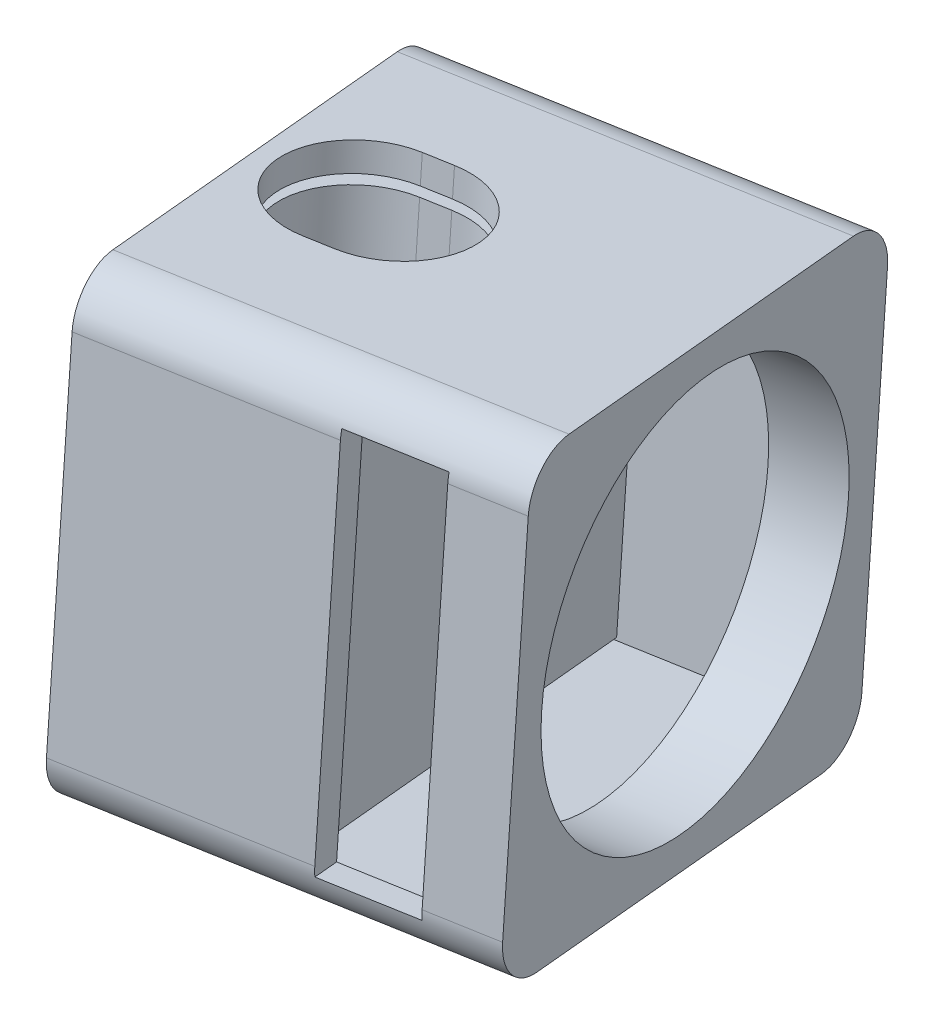
from build123d import *

# Parameters (mm, degrees)
SKETCH1_R           = 4.1
BOSS_EXTRUDE1_DEPTH = 1.5
BOSS_EXTRUDE2_DEPTH = 7
BOSS_EXTRUDE3_START = -7
BOSS_EXTRUDE3_DEPTH = 4.5
CUT_EXTRUDE1_DEPTH  = 45.370101856
FILLET1_R           = 1
CUT_EXTRUDE2_DEPTH  = 43.442087042


with BuildPart() as part:
    # Sketch1 → Boss-Extrude1 (new body)
    with BuildSketch(Plane(origin=(37.190040953, 0, -6.557607634), x_dir=(-0.1736481776669169, 0, -0.9848077530122105), z_dir=(0.9848077530122106, 0, -0.17364817766691693))):
        Polygon((-16.531662389, 5.211492046), (-17.393401075, -4.34975298), (-7.83215605, -5.211491666), (-6.970417363, 4.349753359), align=None)
        with Locations((-12.181909219, 0)):
            Circle(SKETCH1_R, mode=Mode.SUBTRACT)
    extrude(amount=BOSS_EXTRUDE1_DEPTH)

    # Sketch1<3> → Boss-Extrude2 (add)
    with BuildSketch(Plane(origin=(37.190040953, 0, -6.557607634), x_dir=(-0.1736481776669169, 0, -0.9848077530122105), z_dir=(0.9848077530122106, 0, -0.17364817766691693))):
        Polygon((-7.83215605, -5.211491666), (-6.970417363, 4.349753359), (-16.531662389, 5.211492046), (-17.393401075, -4.34975298), align=None)
        Polygon((-8.375875196, -4.560055184), (-7.621853845, 3.806034213), (-15.987943243, 4.560055564), (-16.741964593, -3.806033833), align=None, mode=Mode.SUBTRACT)
    extrude(amount=-BOSS_EXTRUDE2_DEPTH)


with BuildPart() as body_2:
    # Sketch1<4> → Boss-Extrude3 (new body)
    with BuildSketch(Plane(origin=(37.190040953, 0, -6.557607634), x_dir=(-0.1736481776669169, 0, -0.9848077530122105), z_dir=(0.9848077530122106, 0, -0.17364817766691693)).offset(BOSS_EXTRUDE3_START)):
        Polygon((-16.524819099, -3.624794118), (-8.557114911, -4.34290969), (-7.838999339, 3.624794498), (-15.806703527, 4.34291007), align=None)
    extrude(amount=BOSS_EXTRUDE3_DEPTH)


with BuildPart() as cut_extrude1_tool:
    # Sketch2 → Cut-Extrude1 (new, through all)
    with BuildSketch(Plane(origin=(-0.057774785, 3.691534806, -0.327657089), x_dir=(0.9998782702631323, 0.01558743255466835, -0.0006903636436052229), z_dir=(-0.015587432554668353, 0.9959630234822288, -0.08840072286181537))):
        with BuildLine():
            Line((34.650665927, -7.834733366), (35.241550579, -7.730544459))
            ThreePointArc((35.241550579, -7.730544459), (36.5394059, -5.87701497), (34.685876411, -4.57915965))
            Line((34.685876411, -4.57915965), (34.094991759, -4.683348556))
            ThreePointArc((34.094991759, -4.683348556), (32.797136438, -6.536878046), (34.650665927, -7.834733366))
        make_face()
    extrude(amount=-CUT_EXTRUDE1_DEPTH)


with BuildPart() as part_1:
    add(part.part)

    # Cut-Extrude1: cut by cut_extrude1_tool
    add(cut_extrude1_tool.part, mode=Mode.SUBTRACT)

    # Fillet1
    fillet1_edges = [part_1.edges().sort_by_distance(p)[0] for p in [
        (35.692219905, 4.349753359, 0.784445916),
        (35.841859257, -5.211491666, 1.633092856),
        (37.502152032, -4.34975298, 11.049081085),
        (37.35251268, 5.211492046, 10.200434146),
    ]]
    fillet(fillet1_edges, radius=FILLET1_R)

    # Sketch3 → Cut-Extrude2 (cut, through all)
    with BuildSketch(Plane(origin=(2.790110099, 1.448145681, 15.823500677), x_dir=(0.9849311034009463, -0.015762022746430758, -0.17222740836561337), z_dir=(0.1729471640513216, 0.08976444650382359, 0.980832107238781))):
        Polygon((35.713280339, 3.472127719), (35.839887632, -4.52687038), (37.839637157, -4.495218557), (37.713029864, 3.503779542), align=None)
    extrude(amount=CUT_EXTRUDE2_DEPTH, mode=Mode.SUBTRACT)


with BuildPart() as body_2_1:
    add(body_2.part)

    # Cut-Extrude1: cut by cut_extrude1_tool
    add(cut_extrude1_tool.part, mode=Mode.SUBTRACT)


solid = Compound([part_1.part, body_2_1.part])
